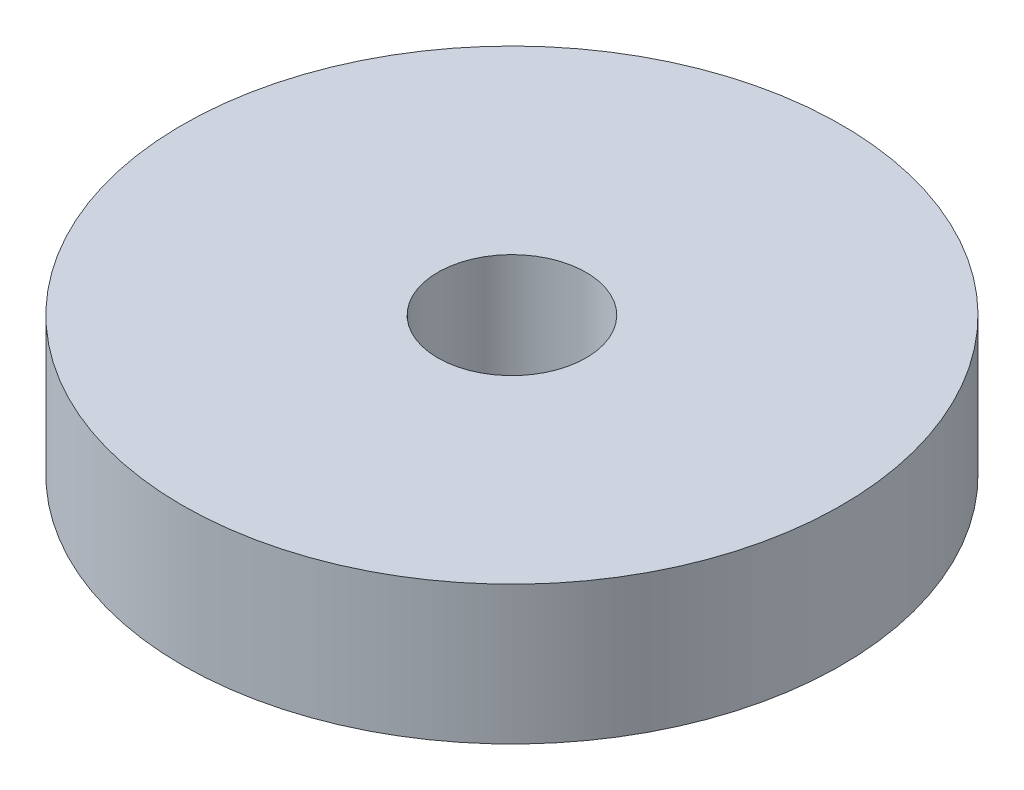
from build123d import *

# Parameters (mm, degrees)
SKETCH1_R            = 10
BOSS_EXTRUDE1_DEPTH  = 4.2
M4_CLEARANCE_HOLE1_D = 4.5


with BuildPart() as part:
    # Sketch1 → Boss-Extrude1 (new body)
    with BuildSketch(Plane(origin=(0, 0, 0), x_dir=(1, 0, 0), z_dir=(0, 1, 0))):
        with Locations(Location((0, 0, 0), (0, 0, 270))):
            Circle(SKETCH1_R)
    extrude(amount=BOSS_EXTRUDE1_DEPTH)

    # M4 Clearance Hole1 (through all)
    with Locations(Plane(origin=(0, 4.2, 0), x_dir=(1, 0, 0), z_dir=(0, 1, 0))):
        with Locations((0, 0)):
            Hole(M4_CLEARANCE_HOLE1_D / 2)


solid = part.part
